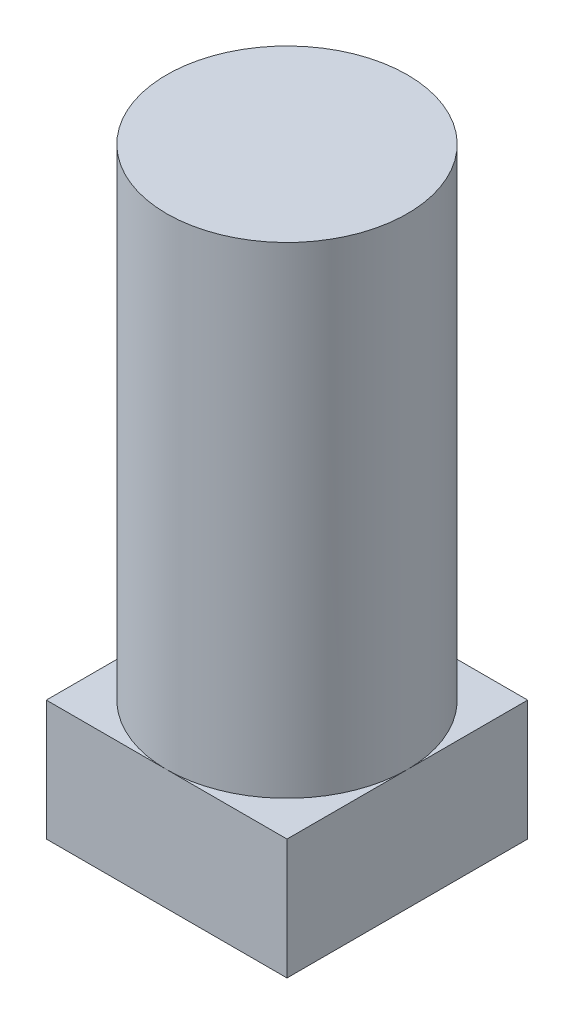
from build123d import *

# Parameters (mm, degrees)
SKETCH_1_R      = 5
EXTRUDE_1_DEPTH = 20
SKETCH_2_W      = 10
SKETCH_2_H      = 10
EXTRUDE_2_DEPTH = 5


with BuildPart() as part:
    # 草图1 → 凸台-拉伸1 (new body)
    with BuildSketch(Plane(origin=(0, 0, 0), x_dir=(1, 0, 0), z_dir=(0, 1, 0))):
        with Locations(Location((0, 0, 0), (0, 0, 270))):
            Circle(SKETCH_1_R)
    extrude(amount=EXTRUDE_1_DEPTH)

    # 草图2 → 凸台-拉伸2 (add)
    with BuildSketch(Plane.XZ):
        Rectangle(SKETCH_2_W, SKETCH_2_H)
    extrude(amount=EXTRUDE_2_DEPTH)


solid = part.part
